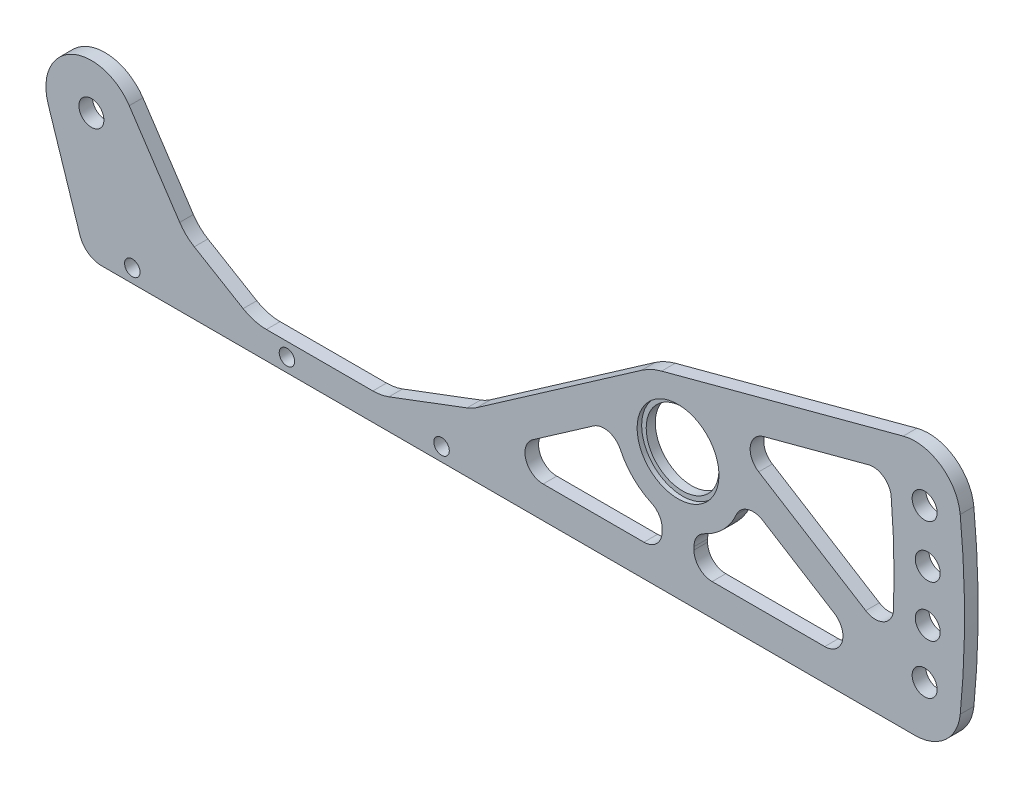
from build123d import *

# Parameters (mm, degrees)
SKETCH_1_R          = 8
EXTRUDE_1_DEPTH     = 3
HOLE_WIZARD_M31_D   = 3.4
HOLE_WIZARD_M51_D   = 5.5
HOLE_WIZARD_M52_D   = 5.5
FILLET_1_R          = 10
FILLET_2_R          = 5
CUT_EXTRUDE_1_DEPTH = 195.061830596
FILLET_3_R          = 4
SKETCH_9_R          = 9
CUT_EXTRUDE_2_DEPTH = 1


with BuildPart() as part:
    # Эскиз1 → Бобышка-Вытянуть1 (new body)
    with BuildSketch(Plane.XY):
        with BuildLine():
            Line((-9.508526364, -3.096437692), (-1.398717752, -28))
            Line((-1.398717752, -28), (189.947361129, -28))
            ThreePointArc((189.947361129, -28), (191.995297124, 1.34383112), (189.536809823, 30.656120467))
            Line((189.536809823, 30.656120467), (125.388049295, 13.526041997))
            ThreePointArc((125.388049295, 13.526041997), (123.105499175, 12.698616461), (121.000225207, 11.489282104))
            Line((121.000225207, 11.489282104), (83.76563687, -14.436473614))
            Line((83.76563687, -14.436473614), (63.718090084, -22))
            Line((63.718090084, -22), (35.731449132, -22))
            Line((35.731449132, -22), (20.675178874, -13.02912429))
            Line((20.675178874, -13.02912429), (8.326583423, 5.537870395))
            ThreePointArc((8.326583423, 5.537870395), (-4.357415095, 9.00071851), (-9.508526364, -3.096437692))
        make_face()
        with Locations((129, 0)):
            Circle(SKETCH_1_R, mode=Mode.SUBTRACT)
    extrude(amount=EXTRUDE_1_DEPTH)

    # Отверстие с зазором M31 (through all)
    with Locations(Plane.XY.offset(3)):
        with Locations((9, -25), (43, -25), (77, -25)):
            Hole(HOLE_WIZARD_M31_D / 2)

    # Отверстие с зазором M51 (through all)
    with Locations(Plane.XY.offset(3)):
        with Locations((0, 0)):
            Hole(HOLE_WIZARD_M51_D / 2)

    # Отверстие с зазором M52 (through all)
    with Locations(Plane.XY.offset(3)):
        with Locations((183.228106674, 16.836297834), (183.914180714, 5.619086431), (183.914180714, -5.619086431), (183.228106674, -16.836297834)):
            Hole(HOLE_WIZARD_M52_D / 2)

    # Скругление1
    fillet_1_edges = [part.edges().sort_by_distance(p)[0] for p in [
        (35.731449132, -22, 1.5),
        (63.718090084, -22, 1.5),
        (83.76563687, -14.436473614, 1.5),
        (189.536809823, 30.656120467, 1.5),
        (189.947361129, -28, 1.5),
        (20.675178874, -13.02912429, 1.5),
    ]]
    fillet(fillet_1_edges, radius=FILLET_1_R)

    # Скругление2
    fillet_2_edges = [part.edges().sort_by_distance(p)[0] for p in [
        (-1.398717752, -28, 1.5),
    ]]
    fillet(fillet_2_edges, radius=FILLET_2_R)

    # Эскиз8 → Вырез-Вытянуть1 (cut, through all)
    with BuildSketch(Plane.XY.offset(3)):
        with BuildLine():
            Line((138.90792063, 9.891062066), (175.404223108, 19.636917172))
            ThreePointArc((175.404223108, 19.636917172), (176.470620047, 3.220288824), (176.003884761, -13.22431658))
            Line((176.003884761, -13.22431658), (138.90792063, 9.891062066))
        make_face()
        with BuildLine():
            Line((142.971746687, -0.888985098), (175.246255309, -21))
            Line((175.246255309, -21), (132.5, -21))
            Line((132.5, -21), (132.5, -13.555441712))
            ThreePointArc((132.5, -13.555441712), (139.790053932, -8.92046726), (142.971746687, -0.888985098))
        make_face()
        with BuildLine():
            Line((115.05010243, -1.183367143), (86.589440581, -21))
            Line((86.589440581, -21), (125.5, -21))
            Line((125.5, -21), (125.5, -13.555441712))
            ThreePointArc((125.5, -13.555441712), (118.304590303, -9.033726331), (115.05010243, -1.183367143))
        make_face()
    extrude(amount=-CUT_EXTRUDE_1_DEPTH, mode=Mode.SUBTRACT)

    # Скругление3
    fillet_3_edges = [part.edges().sort_by_distance(p)[0] for p in [
        (175.404223108, 19.636917172, 1.5),
        (176.003884761, -13.22431658, 1.5),
        (138.90792063, 9.891062066, 1.5),
        (115.05010243, -1.183367143, 1.5),
        (125.5, -13.555441712, 1.5),
        (125.5, -21, 1.5),
        (86.589440581, -21, 1.5),
        (175.246255309, -21, 1.5),
        (132.5, -21, 1.5),
        (132.5, -13.555441712, 1.5),
        (142.971746687, -0.888985098, 1.5),
    ]]
    fillet(fillet_3_edges, radius=FILLET_3_R)

    # Эскиз9 → Вырез-Вытянуть2 (cut)
    with BuildSketch(Plane(origin=(0, 0, 3), x_dir=(-1, 0, 0), z_dir=(0, 0, -1))):
        with Locations((-129, 0)):
            Circle(SKETCH_9_R)
    extrude(amount=CUT_EXTRUDE_2_DEPTH, mode=Mode.SUBTRACT)


solid = part.part
